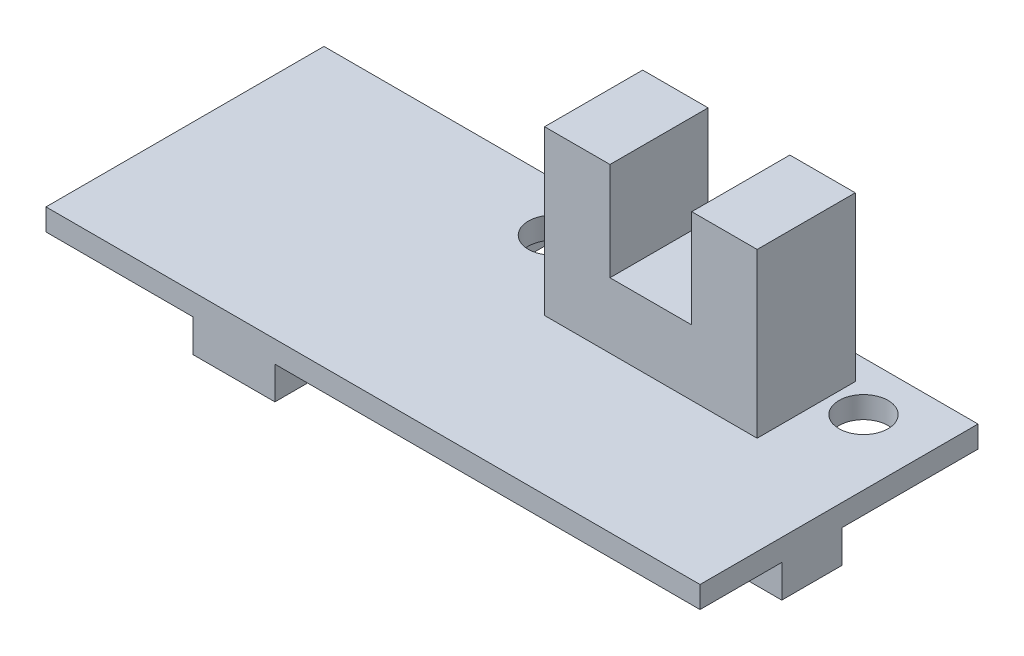
from build123d import *

# Parameters (mm, degrees)
SKETCH_1_W          = 40
SKETCH_1_H          = 17
EXTRUDE_1_DEPTH     = 1.33
SKETCH_3_W          = 26
SKETCH_3_H          = 3.69
EXTRUDE_3_DEPTH     = 2
SKETCH_4_R          = 1.5
CUT_EXTRUDE_1_DEPTH = 22.823152843
SKETCH_2_W          = 4
SKETCH_2_H          = 6
EXTRUDE_4_DEPTH     = 10
SKETCH_5_W          = 5
SKETCH_5_H          = 6
EXTRUDE_5_DEPTH     = 4


with BuildPart() as part:
    # Эскиз1 → Бобышка-Вытянуть1 (new body)
    with BuildSketch(Plane(origin=(0, 0, 0), x_dir=(1, 0, 0), z_dir=(0, 1, 0))):
        Rectangle(SKETCH_1_W, SKETCH_1_H)
    extrude(amount=EXTRUDE_1_DEPTH)

    # Эскиз3 → Бобышка-Вытянуть3 (add)
    with BuildSketch(Plane.XZ):
        Polygon((-11, -8.5), (-6, -8.5), (-6, -0.19), (-6, 3.5), (-6, 8.5), (-11, 8.5), align=None)
        with Locations((7, 1.655)):
            Rectangle(SKETCH_3_W, SKETCH_3_H)
    extrude(amount=EXTRUDE_3_DEPTH)

    # Эскиз4 → Вырез-Вытянуть1 (cut, through all)
    with BuildSketch(Plane.XZ):
        with Locations(Location((16, -5.5, 0), (0, 0, 270))):
            Circle(SKETCH_4_R)
        with Locations(Location((-3, -5.5, 0), (0, 0, 270))):
            Circle(SKETCH_4_R)
    extrude(amount=-CUT_EXTRUDE_1_DEPTH, mode=Mode.SUBTRACT)

    # Эскиз2 → Бобышка-Вытянуть4 (add)
    with BuildSketch(Plane(origin=(0, 1.33, 0), x_dir=(1, 0, 0), z_dir=(0, 1, 0))):
        with Locations((12, 3.992967771)):
            Rectangle(SKETCH_2_W, SKETCH_2_H)
        with Locations((3, 3.992967771)):
            Rectangle(SKETCH_2_W, SKETCH_2_H)
    extrude(amount=EXTRUDE_4_DEPTH)

    # Эскиз5 → Бобышка-Вытянуть5 (add)
    with BuildSketch(Plane(origin=(0, 1.33, 0), x_dir=(1, 0, 0), z_dir=(0, 1, 0))):
        with Locations((7.5, 3.992967771)):
            Rectangle(SKETCH_5_W, SKETCH_5_H)
    extrude(amount=EXTRUDE_5_DEPTH)


solid = part.part
